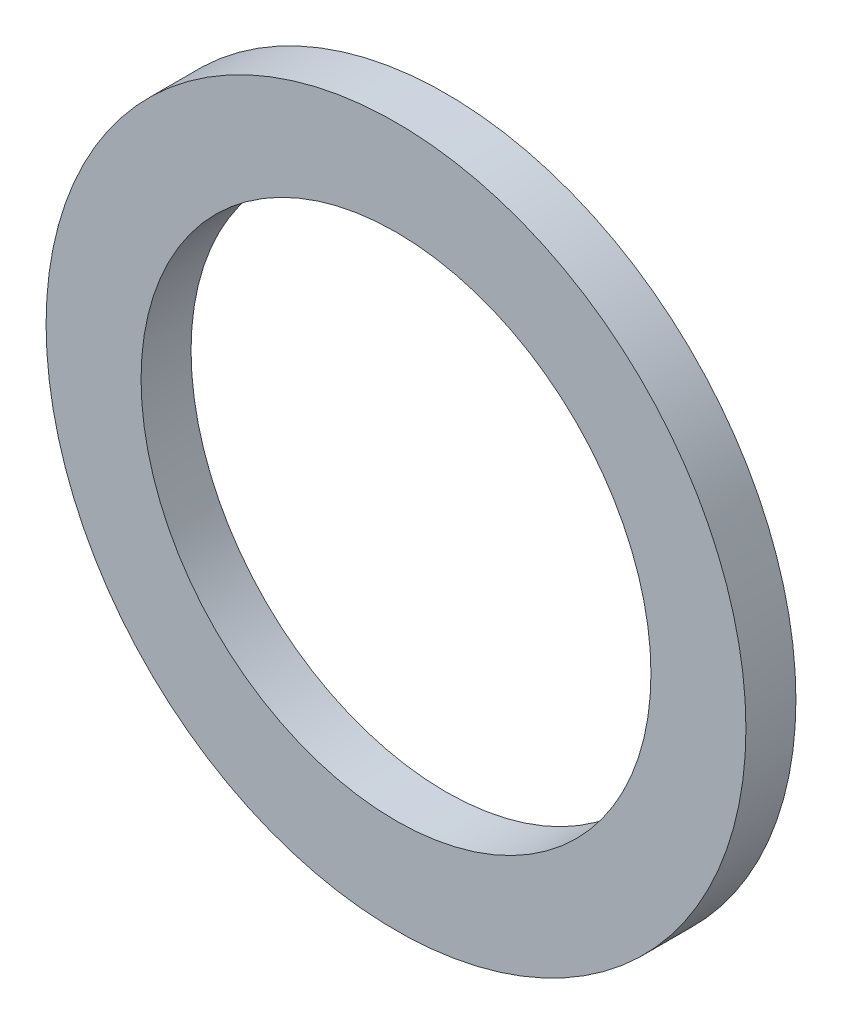
from build123d import *

# Parameters (mm, degrees)
SKETCH_1_R      = 7
SKETCH_1_R_2    = 5.1
EXTRUDE_1_DEPTH = 1


with BuildPart() as part:
    # Эскиз1 → Бобышка-Вытянуть1 (new body)
    with BuildSketch(Plane.XY):
        Circle(SKETCH_1_R)
        Circle(SKETCH_1_R_2, mode=Mode.SUBTRACT)
    extrude(amount=EXTRUDE_1_DEPTH)


solid = part.part
